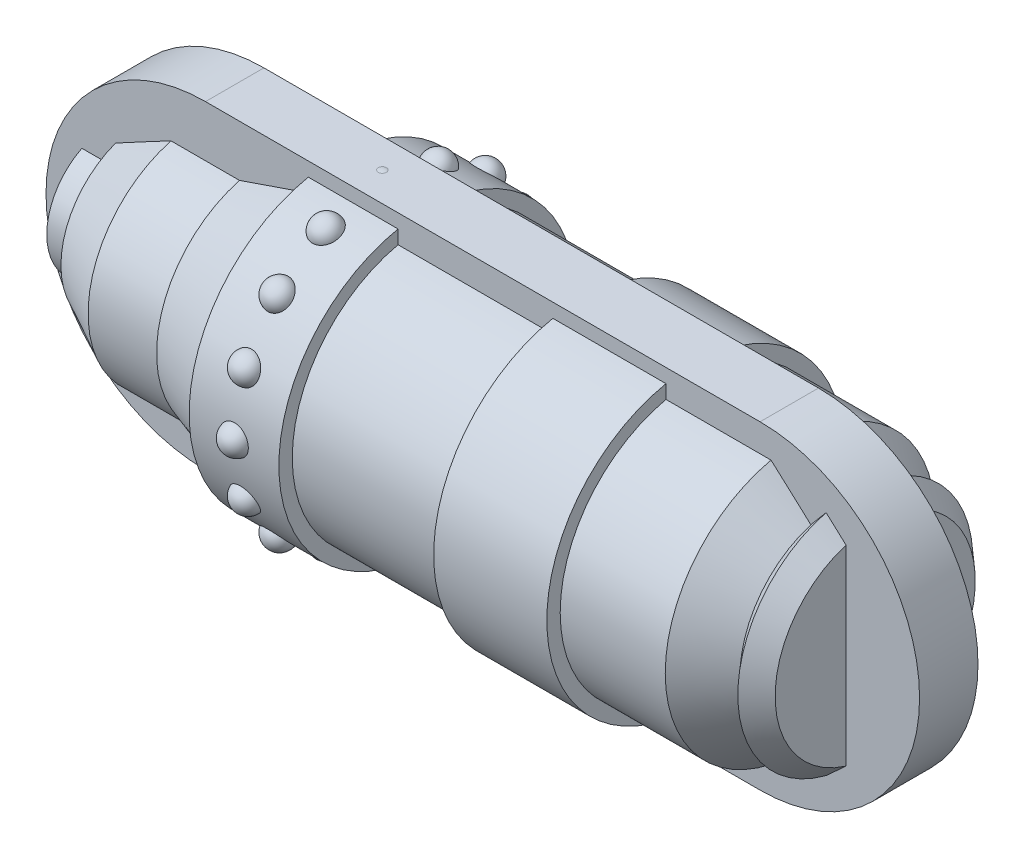
from build123d import *

# Parameters (mm, degrees)
BOSS_EXTRUDE1_DEPTH      = 3.175
BOSS_EXTRUDE1_DEPTH_BACK = 3.175
CIRPATTERN1_COUNT        = 16


with BuildPart() as part:
    # Sketch1 → Revolve1 (revolve)
    with BuildSketch(Plane.XY):
        Polygon((345.045460971, 213.072804364), (428.104411642, 213.072804364), (428.104411642, 223.950819722), (425.943252736, 225.8484055), (424.277094928, 223.950819722), (419.954777117, 227.745991278), (408.537310939, 227.745991278), (408.537310939, 229.201548055), (396.239229231, 229.201548055), (396.239229231, 227.745991278), (379.413831729, 227.745991278), (379.413831729, 229.201548055), (369.659616023, 229.201548055), (369.659616023, 227.745991278), (362.181076576, 225.258938694), (354.735947037, 225.258938694), (348.70893741, 222.186345551), (348.70893741, 220.059165683), (345.045460971, 220.059165683), align=None)
    revolve(axis=Axis((345.045460971, 213.072804364, 0), (1, 0, 0)))

    # Sketch2 → Boss-Extrude1 (add, two sides: drawn at the far end of the back side and taken through both)
    with BuildSketch(Plane.XY.offset(-BOSS_EXTRUDE1_DEPTH_BACK)):
        with BuildLine():
            Line((358.486145239, 195.735746018), (418.763735056, 195.735746018))
            ThreePointArc((418.763735056, 195.735746018), (436.100793403, 213.072804364), (418.763735056, 230.409862711))
            Line((418.763735056, 230.409862711), (358.486145239, 230.409862711))
            ThreePointArc((358.486145239, 230.409862711), (341.149086892, 213.072804364), (358.486145239, 195.735746018))
        make_face()
    extrude(amount=BOSS_EXTRUDE1_DEPTH + BOSS_EXTRUDE1_DEPTH_BACK)

    # Sketch3 → Revolve2 (revolve)
    with BuildSketch(Plane.XY):
        with BuildLine():
            Line((372.949223876, 228.885955475), (376.124223876, 228.885955475))
            ThreePointArc((376.124223876, 228.885955475), (374.536723876, 230.473455475), (372.949223876, 228.885955475))
        make_face()
    revolve2 = revolve(axis=Axis((372.949223876, 228.885955475, 0), (1, 0, 0)))

    # CirPattern1: Revolve2 ×16 about axis
    cirpattern1_axis = Axis((345.045460971, 213.072804364, 0), (-1, 0, 0))
    for i in range(1, CIRPATTERN1_COUNT):
        add(revolve2.rotate(cirpattern1_axis, i * 360 / CIRPATTERN1_COUNT))


solid = part.part
